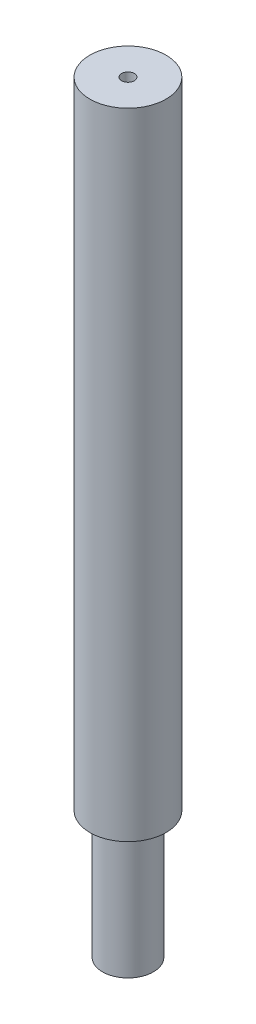
from build123d import *

# Parameters (mm, degrees)
SKETCH1_R           = 2.54
BOSS_EXTRUDE1_DEPTH = 12.7
SKETCH2_R           = 3.81
BOSS_EXTRUDE2_DEPTH = 63.5
SKETCH3_R           = 0.635
CUT_EXTRUDE1_DEPTH  = 77.390262468


with BuildPart() as part:
    # Sketch1 → Boss-Extrude1 (new body)
    with BuildSketch(Plane(origin=(0, 0, 0), x_dir=(1, 0, 0), z_dir=(0, 1, 0))):
        with Locations(Location((0, 0, 0), (0, 0, 270))):
            Circle(SKETCH1_R)
    extrude(amount=BOSS_EXTRUDE1_DEPTH)

    # Sketch2 → Boss-Extrude2 (add)
    with BuildSketch(Plane(origin=(0, 12.7, 0), x_dir=(1, 0, 0), z_dir=(0, 1, 0))):
        with Locations(Location((0, 0, 0), (0, 0, 270))):
            Circle(SKETCH2_R)
    extrude(amount=BOSS_EXTRUDE2_DEPTH)

    # Sketch3 → Cut-Extrude1 (cut, through all)
    with BuildSketch(Plane(origin=(0, 76.2, 0), x_dir=(1, 0, 0), z_dir=(0, 1, 0))):
        with Locations(Location((0, 0, 0), (0, 0, 270))):
            Circle(SKETCH3_R)
    extrude(amount=-CUT_EXTRUDE1_DEPTH, mode=Mode.SUBTRACT)


solid = part.part
